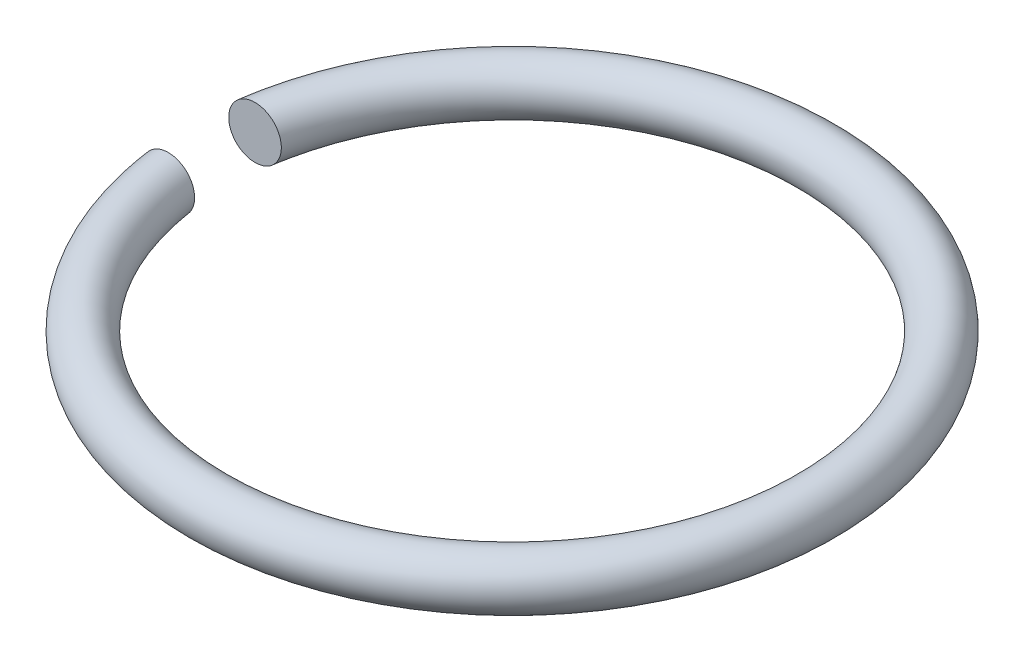
from build123d import *

# Parameters (mm, degrees)
SKETCH_1_R               = 0.6
CUT_EXTRUDE_1_DEPTH      = 11.814804819
CUT_EXTRUDE_1_DEPTH_BACK = 11.814804819
SKETCH_2_W               = 9.354768312
SKETCH_2_H               = 2


with BuildPart() as part:
    # Эскиз1 → Повернуть1 (revolve)
    with BuildSketch(Plane.XY, mode=Mode.PRIVATE) as revolve_1_sk:
        with Locations((-7, 0.6)):
            Circle(SKETCH_1_R)
    revolve(revolve_1_sk.sketch.rotate(Axis((0, 0, 0), (0, 1, 0)), 270), axis=Axis((0, 0, 0), (0, 1, 0)))

    # Эскиз2 → Вырез-Вытянуть1 (cut, two sides: drawn at the far end of the back side and taken through both)
    with BuildSketch(Plane(origin=(0, 0, 0), x_dir=(1, 0, 0), z_dir=(0, 1, 0)).offset(-CUT_EXTRUDE_1_DEPTH_BACK)):
        with Locations((-7.484613341, 0)):
            Rectangle(SKETCH_2_W, SKETCH_2_H)
    extrude(amount=CUT_EXTRUDE_1_DEPTH + CUT_EXTRUDE_1_DEPTH_BACK, mode=Mode.SUBTRACT)


solid = part.part
